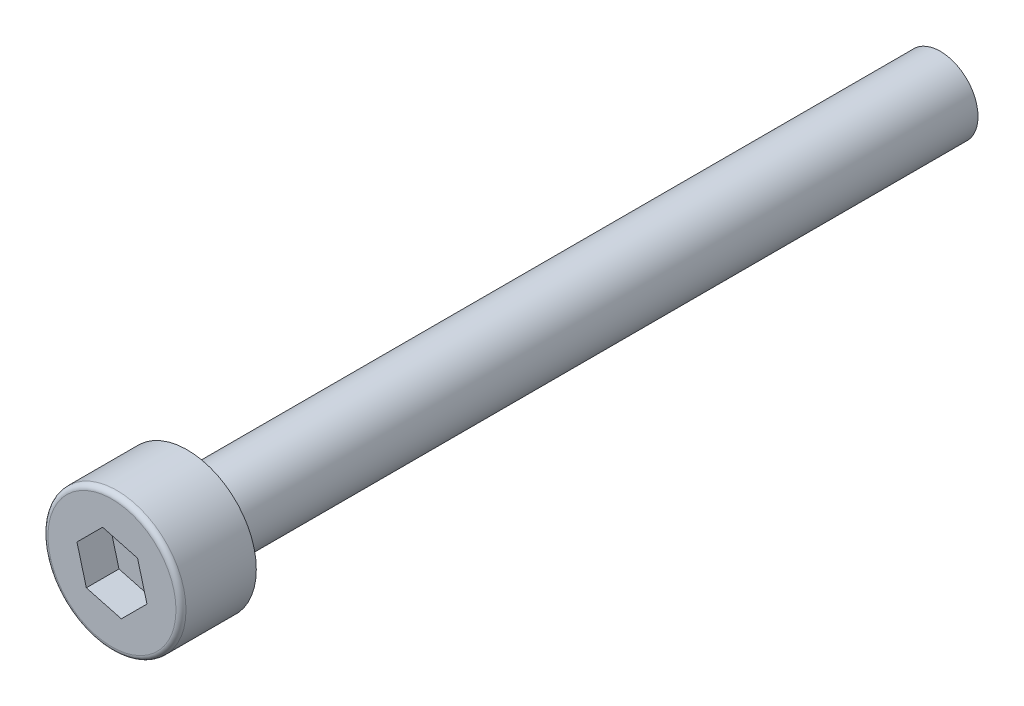
from build123d import *

# Parameters (mm, degrees)
SKETCH_1_R          = 2.75
EXTRUDE_1_DEPTH     = 3
CUT_EXTRUDE_1_DEPTH = 1.3
SKETCH_3_R          = 1.5
EXTRUDE_2_DEPTH     = 30
FILLET_1_R          = 0.2


with BuildPart() as part:
    # 草图1 → 凸台-拉伸1 (new body)
    with BuildSketch(Plane.XY):
        Circle(SKETCH_1_R)
    extrude(amount=EXTRUDE_1_DEPTH)

    # 草图2 → 切除-拉伸1 (cut)
    with BuildSketch(Plane.XY.offset(3)):
        Polygon((-1.020620726, -1.020620726), (0.373573113, -1.39419384), (1.39419384, -0.373573113), (1.020620726, 1.020620726), (-0.373573113, 1.39419384), (-1.39419384, 0.373573113), align=None)
    extrude(amount=-CUT_EXTRUDE_1_DEPTH, mode=Mode.SUBTRACT)

    # 草图3 → 凸台-拉伸2 (add)
    with BuildSketch(Plane(origin=(0, 0, 0), x_dir=(-1, 0, 0), z_dir=(0, 0, -1))):
        with Locations(Location((0, 0, 0), (0, 0, 180))):
            Circle(SKETCH_3_R)
    extrude(amount=EXTRUDE_2_DEPTH)

    # 圆角1
    fillet_1_edges = [part.edges().sort_by_distance(p)[0] for p in [
        (-2.75, 0, 3),
    ]]
    fillet(fillet_1_edges, radius=FILLET_1_R)


solid = part.part
